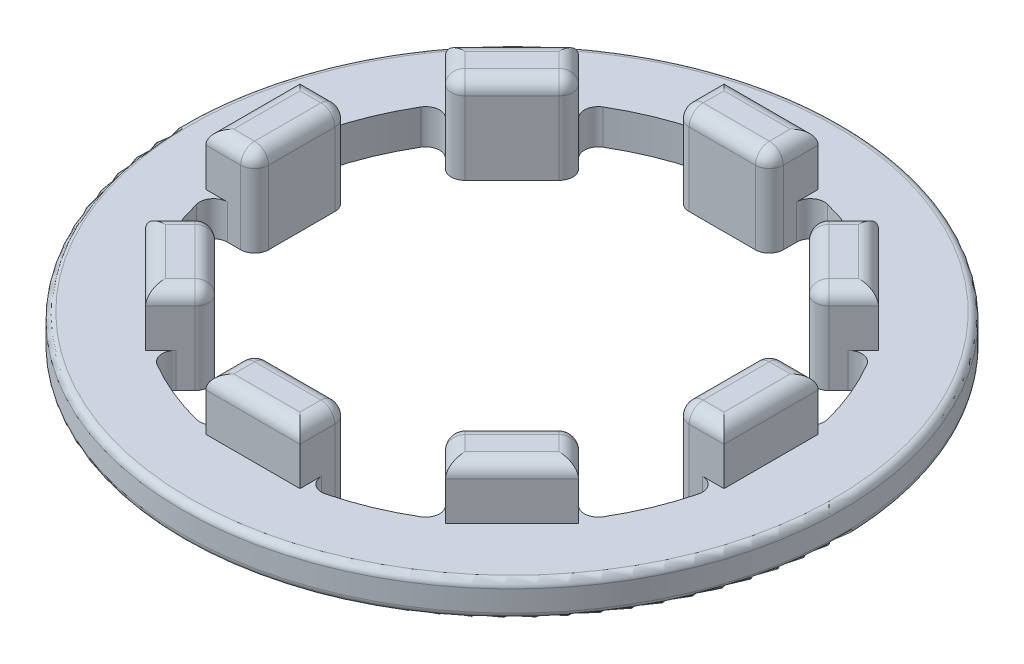
from build123d import *

# Parameters (mm, degrees)
SKETCH2_R                = 4.725
SKETCH2_R_2              = 3.715
BOSS_EXTRUDE1_DEPTH      = 0.5
SKETCH3_W                = 1.35
SKETCH3_H                = 0.7
BOSS_EXTRUDE2_DEPTH      = 1.25
FILLET1_R                = 0.2
CIRPATTERN1_COUNT        = 8
FILLET1_OF_CIRPATTERN1_R = 0.2
FILLET2_R                = 0.1


with BuildPart() as part:
    # Sketch2 → Boss-Extrude1 (new body)
    with BuildSketch(Plane(origin=(0, 0, 0), x_dir=(1, 0, 0), z_dir=(0, 1, 0))):
        Circle(SKETCH2_R)
        Circle(SKETCH2_R_2, mode=Mode.SUBTRACT)
    extrude(amount=BOSS_EXTRUDE1_DEPTH)

    # Sketch3 → Boss-Extrude2 (add)
    with BuildSketch(Plane.XZ):
        with Locations((0, -3.365)):
            Rectangle(SKETCH3_W, SKETCH3_H)
    boss_extrude2 = extrude(amount=-BOSS_EXTRUDE2_DEPTH)

    # Fillet1
    fillet1_edges = [part.edges().sort_by_distance(p)[0] for p in [
        (0, 1.25, -3.015),
        (-0.675, 1.25, -3.365),
        (0, 1.25, -3.715),
        (0.675, 1.25, -3.365),
        (-0.675, 0.25, -3.653163013),
        (0.675, 0.25, -3.653163013),
        (0.675, 0.625, -3.015),
        (-0.675, 0.625, -3.015),
    ]]
    fillet(fillet1_edges, radius=FILLET1_R)

    # CirPattern1: Boss-Extrude2 ×8 about axis
    cirpattern1_axis = Axis((0, 0.5, 0), (0, -1, 0))
    for i in range(1, CIRPATTERN1_COUNT):
        add(boss_extrude2.rotate(cirpattern1_axis, i * 360 / CIRPATTERN1_COUNT))

    # Fillet1 of CirPattern1
    fillet1_of_cirpattern1_edges = [part.edges().sort_by_distance(p)[0] for p in [
        (2.131926945, 1.25, -2.131926945),
        (1.902117241, 1.25, -2.856711396),
        (2.626901692, 1.25, -2.626901692),
        (2.856711396, 1.25, -1.902117241),
        (2.105879262, 0.25, -3.060473417),
        (3.060473417, 0.25, -2.105879262),
        (2.609224023, 0.625, -1.654629868),
        (1.654629868, 0.625, -2.609224023),
        (3.015, 1.25, 0),
        (3.365, 1.25, -0.675),
        (3.715, 1.25, 0),
        (3.365, 1.25, 0.675),
        (3.653163013, 0.25, -0.675),
        (3.653163013, 0.25, 0.675),
        (3.015, 0.625, 0.675),
        (3.015, 0.625, -0.675),
        (2.131926945, 1.25, 2.131926945),
        (2.856711396, 1.25, 1.902117241),
        (2.626901692, 1.25, 2.626901692),
        (1.902117241, 1.25, 2.856711396),
        (3.060473417, 0.25, 2.105879262),
        (2.105879262, 0.25, 3.060473417),
        (1.654629868, 0.625, 2.609224023),
        (2.609224023, 0.625, 1.654629868),
        (0, 1.25, 3.015),
        (0.675, 1.25, 3.365),
        (0, 1.25, 3.715),
        (-0.675, 1.25, 3.365),
        (0.675, 0.25, 3.653163013),
        (-0.675, 0.25, 3.653163013),
        (-0.675, 0.625, 3.015),
        (0.675, 0.625, 3.015),
        (-2.131926945, 1.25, 2.131926945),
        (-1.902117241, 1.25, 2.856711396),
        (-2.626901692, 1.25, 2.626901692),
        (-2.856711396, 1.25, 1.902117241),
        (-2.105879262, 0.25, 3.060473417),
        (-3.060473417, 0.25, 2.105879262),
        (-2.609224023, 0.625, 1.654629868),
        (-1.654629868, 0.625, 2.609224023),
        (-3.015, 1.25, 0),
        (-3.365, 1.25, 0.675),
        (-3.715, 1.25, 0),
        (-3.365, 1.25, -0.675),
        (-3.653163013, 0.25, 0.675),
        (-3.653163013, 0.25, -0.675),
        (-3.015, 0.625, -0.675),
        (-3.015, 0.625, 0.675),
        (-2.131926945, 1.25, -2.131926945),
        (-2.856711396, 1.25, -1.902117241),
        (-2.626901692, 1.25, -2.626901692),
        (-1.902117241, 1.25, -2.856711396),
        (-3.060473417, 0.25, -2.105879262),
        (-2.105879262, 0.25, -3.060473417),
        (-1.654629868, 0.625, -2.609224023),
        (-2.609224023, 0.625, -1.654629868),
    ]]
    fillet(fillet1_of_cirpattern1_edges, radius=FILLET1_OF_CIRPATTERN1_R)

    # Fillet2
    fillet2_edges = [part.edges().sort_by_distance(p)[0] for p in [
        (-4.725, 0, 0),
        (-4.725, 0.5, 0),
    ]]
    fillet(fillet2_edges, radius=FILLET2_R)


solid = part.part
